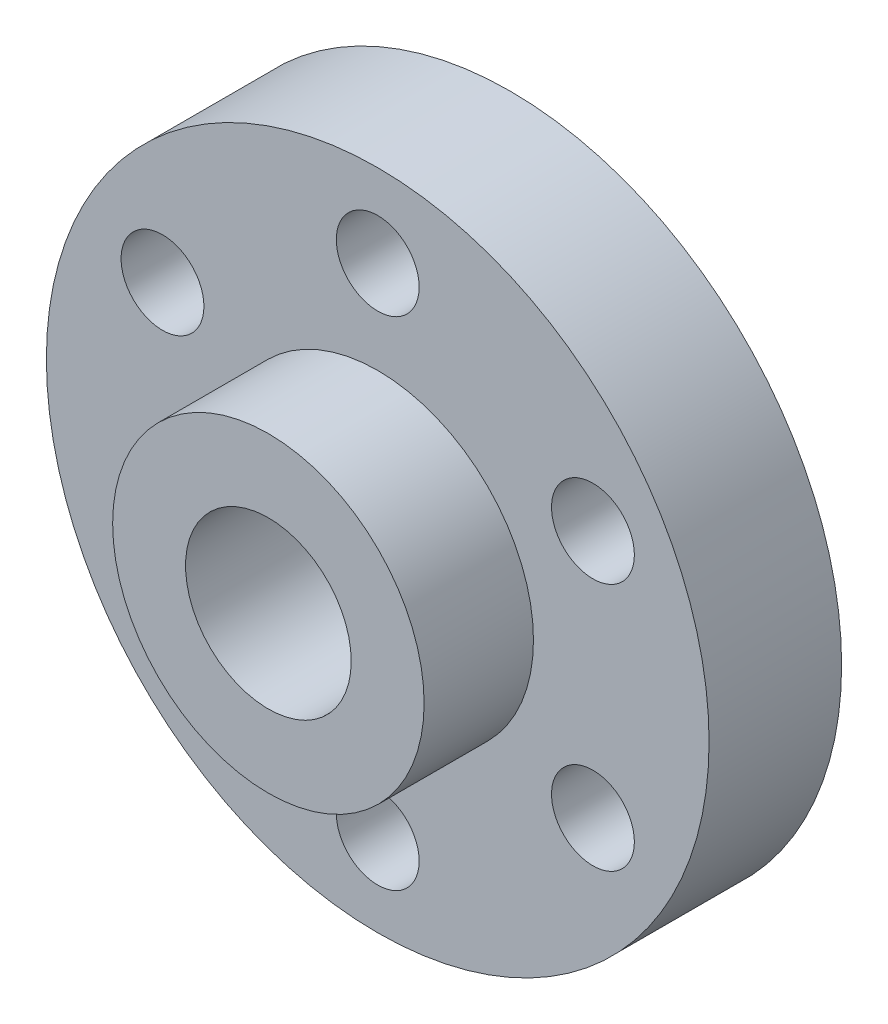
from build123d import *

# Parameters (mm, degrees)
SKETCH1_R           = 12.7
SKETCH1_R_2         = 1.5875
BOSS_EXTRUDE1_DEPTH = 5.08
SKETCH2_R           = 5.969
BOSS_EXTRUDE2_DEPTH = 4.191
SKETCH3_R           = 3.175
CUT_EXTRUDE1_DEPTH  = 9.271


with BuildPart() as part:
    # Sketch1 → Boss-Extrude1 (new body)
    with BuildSketch(Plane.XY):
        Circle(SKETCH1_R)
        with Locations((0, 9.525)):
            Circle(SKETCH1_R_2, mode=Mode.SUBTRACT)
        with Locations((8.248891971, 4.7625)):
            Circle(SKETCH1_R_2, mode=Mode.SUBTRACT)
        with Locations((8.248891971, -4.7625)):
            Circle(SKETCH1_R_2, mode=Mode.SUBTRACT)
        with Locations((0, -9.525)):
            Circle(SKETCH1_R_2, mode=Mode.SUBTRACT)
        with Locations((-8.248891971, -4.7625)):
            Circle(SKETCH1_R_2, mode=Mode.SUBTRACT)
        with Locations((-8.248891971, 4.7625)):
            Circle(SKETCH1_R_2, mode=Mode.SUBTRACT)
    extrude(amount=BOSS_EXTRUDE1_DEPTH)

    # Sketch2 → Boss-Extrude2 (add)
    with BuildSketch(Plane.XY.offset(5.08)):
        Circle(SKETCH2_R)
    extrude(amount=BOSS_EXTRUDE2_DEPTH)

    # Sketch3 → Cut-Extrude1 (cut)
    with BuildSketch(Plane.XY.offset(9.271)):
        Circle(SKETCH3_R)
    extrude(amount=-CUT_EXTRUDE1_DEPTH, mode=Mode.SUBTRACT)


solid = part.part
